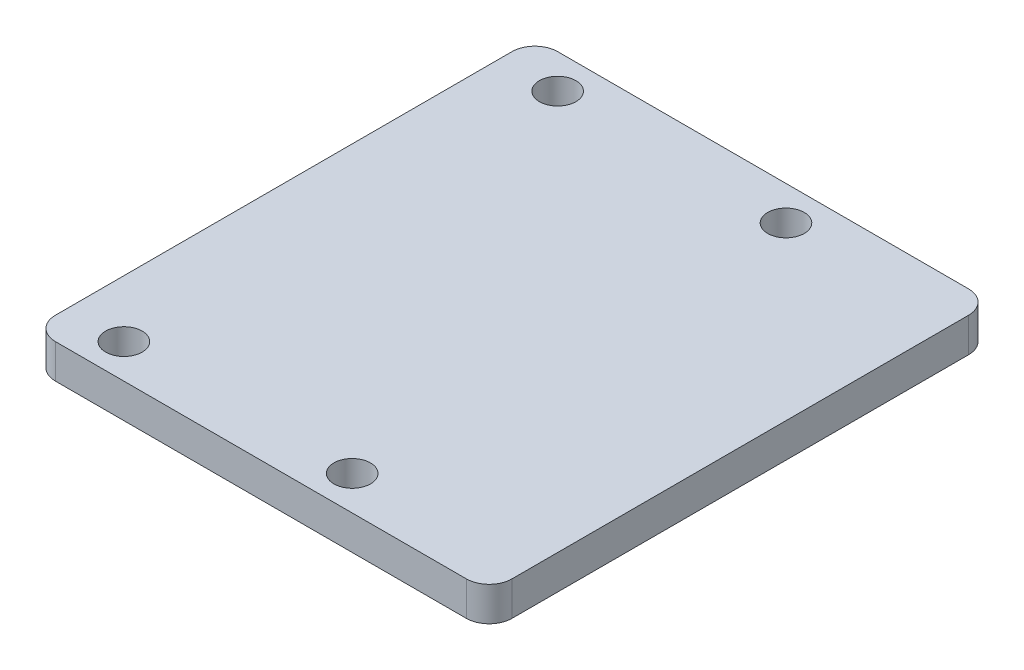
from build123d import *

# Parameters (mm, degrees)
SKETCH_1_W      = 40
SKETCH_1_H      = 44
SKETCH_1_R      = 1.6
EXTRUDE_1_DEPTH = 3
FILLET_1_R      = 2


with BuildPart() as part:
    # 草图1 → 凸台-拉伸1 (new body)
    with BuildSketch(Plane(origin=(0, 0, 0), x_dir=(1, 0, 0), z_dir=(0, 1, 0))):
        Rectangle(SKETCH_1_W, SKETCH_1_H)
        with Locations(Location((-15, -19, 0), (0, 0, 270))):
            Circle(SKETCH_1_R, mode=Mode.SUBTRACT)
        with Locations(Location((5, -19, 0), (0, 0, 270))):
            Circle(SKETCH_1_R, mode=Mode.SUBTRACT)
        with Locations(Location((5, 19, 0), (0, 0, 90))):
            Circle(SKETCH_1_R, mode=Mode.SUBTRACT)
        with Locations(Location((-15, 19, 0), (0, 0, 90))):
            Circle(SKETCH_1_R, mode=Mode.SUBTRACT)
    extrude(amount=EXTRUDE_1_DEPTH)

    # 圆角1
    fillet_1_edges = [part.edges().sort_by_distance(p)[0] for p in [
        (20, 1.5, 22),
        (-20, 1.5, 22),
        (-20, 1.5, -22),
        (20, 1.5, -22),
    ]]
    fillet(fillet_1_edges, radius=FILLET_1_R)


solid = part.part
